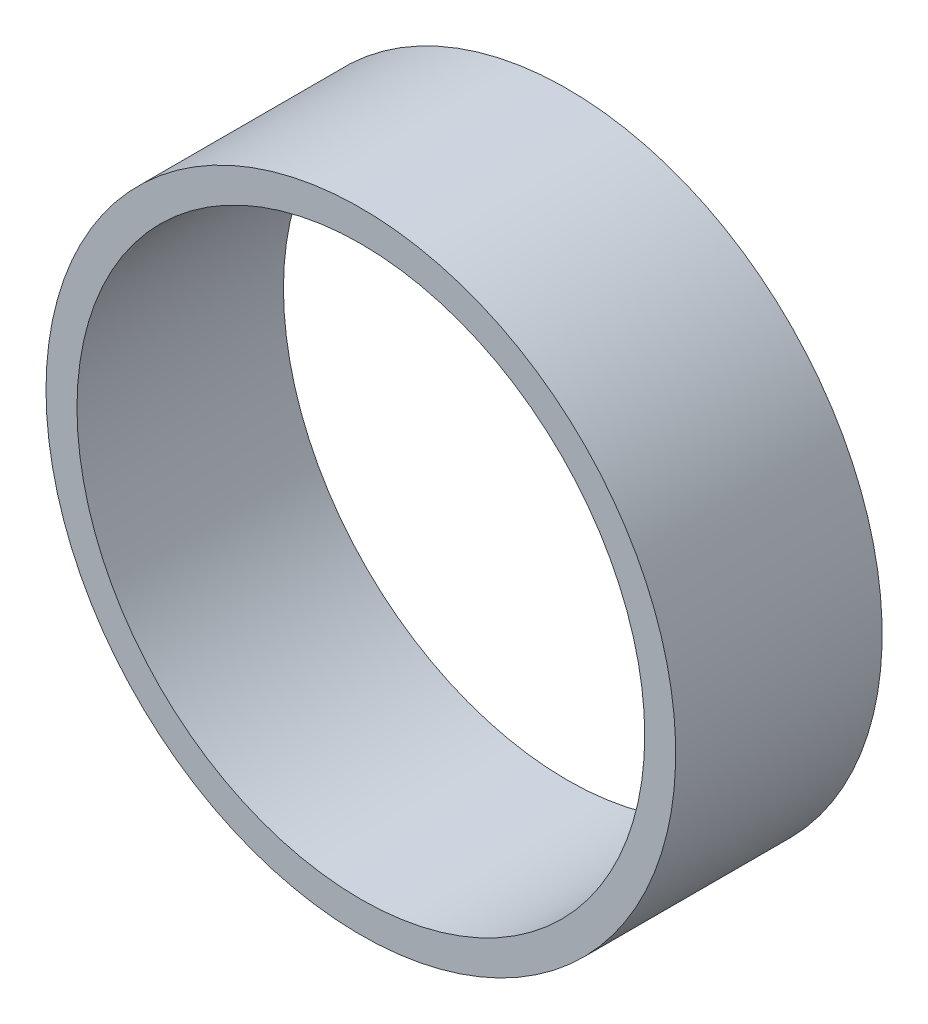
from build123d import *

# Parameters (mm, degrees)
SKETCH1_R           = 30.5
SKETCH1_R_2         = 27.5
BOSS_EXTRUDE1_DEPTH = 20


with BuildPart() as part:
    # Sketch1 → Boss-Extrude1 (new body)
    with BuildSketch(Plane.XY):
        with Locations(Location((0, 0, 0), (0, 0, 180))):
            Circle(SKETCH1_R)
        with Locations(Location((0, 0, 0), (0, 0, 180))):
            Circle(SKETCH1_R_2, mode=Mode.SUBTRACT)
    extrude(amount=BOSS_EXTRUDE1_DEPTH)


solid = part.part
